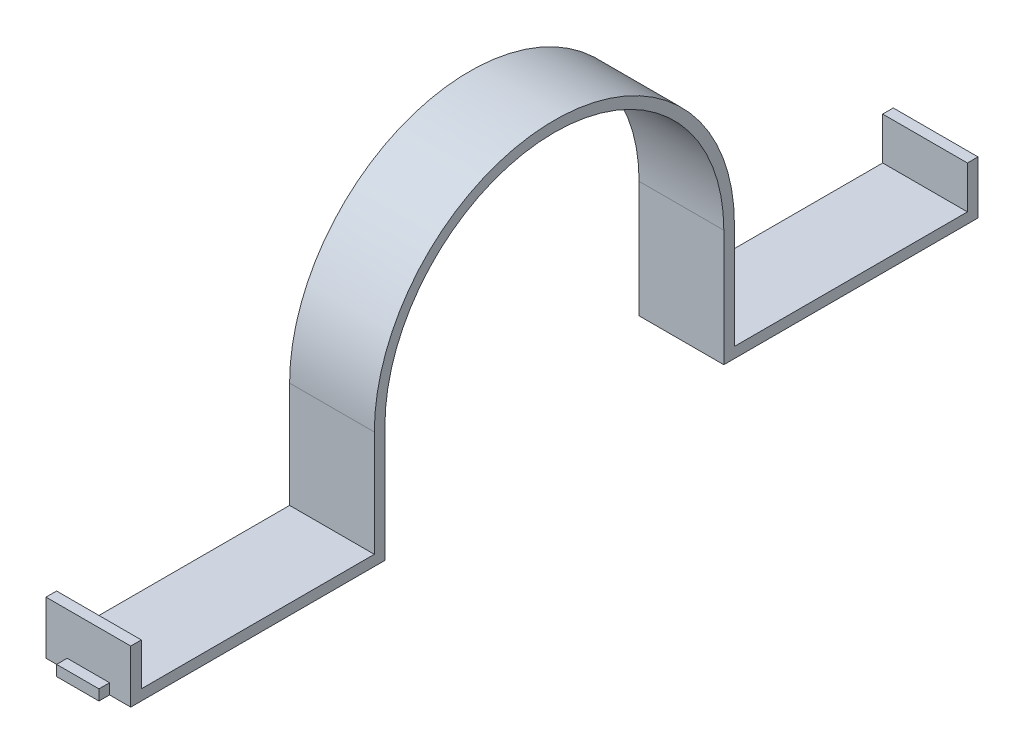
from build123d import *

# Parameters (mm, degrees)
BOSS_EXTRUDE1_DEPTH = 25.4
BOSS_EXTRUDE2_REACH = 380.558
SKETCH2_W           = 50.8
SKETCH2_H           = 6.35
SKETCH3_W           = 25.4
SKETCH3_H           = 6.35
BOSS_EXTRUDE3_DEPTH = 6.35
SKETCH4_W           = 50.8
SKETCH4_H           = 6.35
BOSS_EXTRUDE4_DEPTH = 25.4


with BuildPart() as part:
    # Sketch1 → Boss-Extrude1 (new, symmetric)
    with BuildSketch(Plane(origin=(0, 0, 0), x_dir=(0, 0, -1), z_dir=(1, 0, 0))):
        with BuildLine():
            Line((-107.95, 0), (-107.95, -69.85))
            Line((-107.95, -69.85), (-101.6, -69.85))
            Line((-101.6, -69.85), (-101.6, 0))
            ThreePointArc((-101.6, 0), (0, 101.6), (101.6, 0))
            Line((101.6, 0), (101.6, -69.85))
            Line((101.6, -69.85), (107.95, -69.85))
            Line((107.95, -69.85), (107.95, 0))
            ThreePointArc((107.95, 0), (0, 107.95), (-107.95, 0))
        make_face()
    extrude(amount=BOSS_EXTRUDE1_DEPTH, both=True)

    # Sketch2 → Boss-Extrude2 (add, up to next)
    with BuildSketch(Plane.XY.offset(254), mode=Mode.PRIVATE) as boss_extrude2_sk1:
        with Locations((0, -66.675)):
            Rectangle(SKETCH2_W, SKETCH2_H)
    boss_extrude2_tool1 = extrude(boss_extrude2_sk1.sketch, amount=-BOSS_EXTRUDE2_REACH, mode=Mode.PRIVATE) - part.part
    boss_extrude2 = boss_extrude2_tool1.solids().sort_by_distance((0, -66.675, 254))[0]
    add(boss_extrude2)

    # Mirror1: Boss-Extrude2 across plane
    add(boss_extrude2.mirror(Plane.XY))

    # Sketch3 → Boss-Extrude3 (add)
    with BuildSketch(Plane(origin=(0, -63.5, 0), x_dir=(1, 0, 0), z_dir=(0, 1, 0))):
        with Locations((0, -257.175)):
            Rectangle(SKETCH3_W, SKETCH3_H)
    boss_extrude3 = extrude(amount=-BOSS_EXTRUDE3_DEPTH)

    # Mirror2: Boss-Extrude3 across plane
    add(boss_extrude3.mirror(Plane.XY))

    # Sketch4 → Boss-Extrude4 (add)
    with BuildSketch(Plane(origin=(0, -63.5, 0), x_dir=(1, 0, 0), z_dir=(0, 1, 0))):
        with Locations((0, -250.825)):
            Rectangle(SKETCH4_W, SKETCH4_H)
    boss_extrude4 = extrude(amount=BOSS_EXTRUDE4_DEPTH)

    # Mirror3: Boss-Extrude4 across plane
    add(boss_extrude4.mirror(Plane.XY))


solid = part.part
